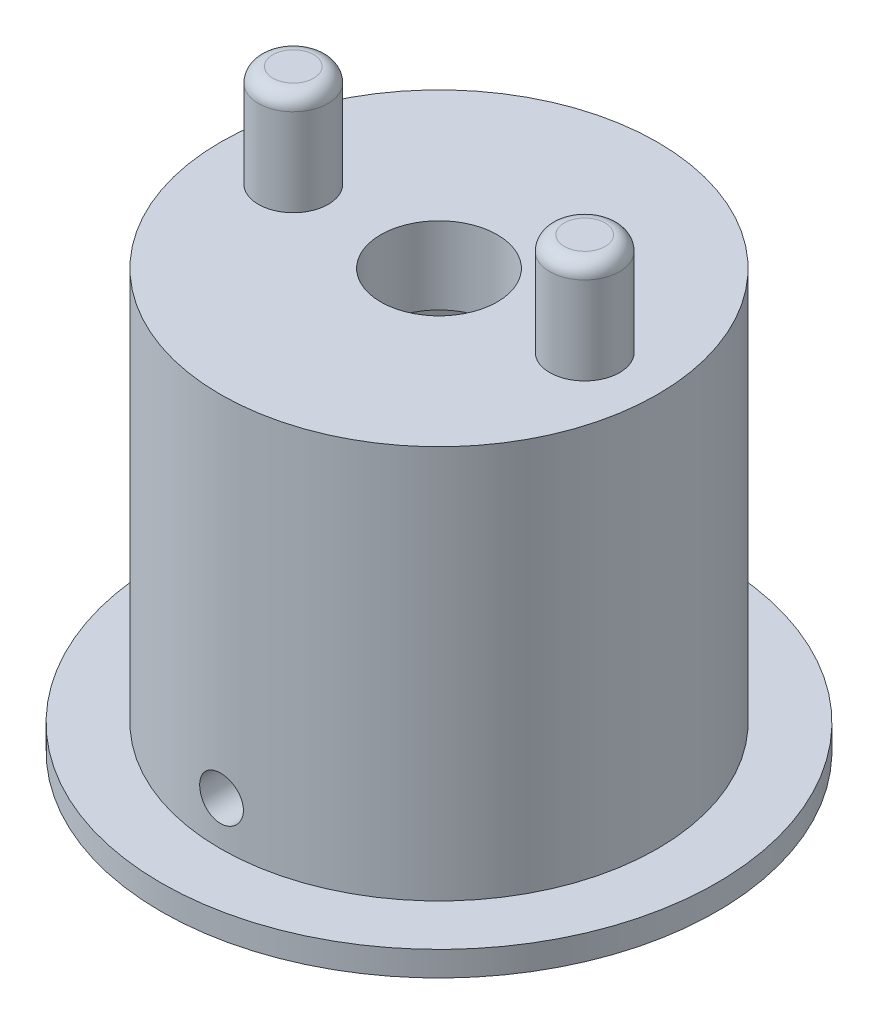
from build123d import *

# Parameters (mm, degrees)
SKETCH1_R               = 15
BOSS_EXTRUDE1_DEPTH     = 27
SKETCH2_R               = 19.07
BOSS_EXTRUDE2_DEPTH     = 1.7
CUT_EXTRUDE1_DEPTH      = 23.4
SKETCH4_R               = 4
CUT_EXTRUDE2_DEPTH      = 5.3
SKETCH5_R               = 2.4
BOSS_EXTRUDE3_DEPTH     = 7
FILLET1_R               = 1
CUT_EXTRUDE3_DEPTH      = 44.397347845
CUT_EXTRUDE3_DEPTH_BACK = 44.397347845
SKETCH6_R               = 1.5


with BuildPart() as part:
    # Sketch1 → Boss-Extrude1 (new body)
    with BuildSketch(Plane(origin=(0, 0, 0), x_dir=(1, 0, 0), z_dir=(0, 1, 0))):
        with Locations(Location((0, 0, 0), (0, 0, 270))):
            Circle(SKETCH1_R)
    extrude(amount=BOSS_EXTRUDE1_DEPTH)

    # Sketch2 → Boss-Extrude2 (add)
    with BuildSketch(Plane.XZ):
        with Locations(Location((0, 0, 0), (0, 0, 270))):
            Circle(SKETCH2_R)
    extrude(amount=BOSS_EXTRUDE2_DEPTH)

    # Sketch3 → Cut-Extrude1 (cut)
    with BuildSketch(Plane.XZ.offset(1.7)):
        Polygon((-2.800148806, 4.85), (-5.600297611, 0), (-2.800148806, -4.85), (2.800148806, -4.85), (5.600297611, 0), (2.800148806, 4.85), align=None)
    extrude(amount=-CUT_EXTRUDE1_DEPTH, mode=Mode.SUBTRACT)

    # Sketch4 → Cut-Extrude2 (cut)
    with BuildSketch(Plane.XZ.offset(-21.7)):
        with Locations(Location((0, 0, 0), (0, 0, 270))):
            Circle(SKETCH4_R)
    extrude(amount=-CUT_EXTRUDE2_DEPTH, mode=Mode.SUBTRACT)

    # Sketch5 → Boss-Extrude3 (add)
    with BuildSketch(Plane(origin=(0, 27, 0), x_dir=(1, 0, 0), z_dir=(0, 1, 0))):
        with Locations(Location((-10, 0, 0), (0, 0, 270))):
            Circle(SKETCH5_R)
        with Locations(Location((10, 0, 0), (0, 0, 270))):
            Circle(SKETCH5_R)
    extrude(amount=BOSS_EXTRUDE3_DEPTH)

    # Fillet1
    fillet1_edges = [part.edges().sort_by_distance(p)[0] for p in [
        (-10, 34, -2.4),
        (10, 34, -2.4),
    ]]
    fillet(fillet1_edges, radius=FILLET1_R)

    # Sketch6 → Cut-Extrude3 (cut, two sides: drawn at the far end of the back side and taken through both)
    with BuildSketch(Plane.XY.offset(-CUT_EXTRUDE3_DEPTH_BACK)):
        with Locations(Location((0, 3, 0), (0, 0, 90))):
            Circle(SKETCH6_R)
    extrude(amount=CUT_EXTRUDE3_DEPTH + CUT_EXTRUDE3_DEPTH_BACK, mode=Mode.SUBTRACT)


solid = part.part
